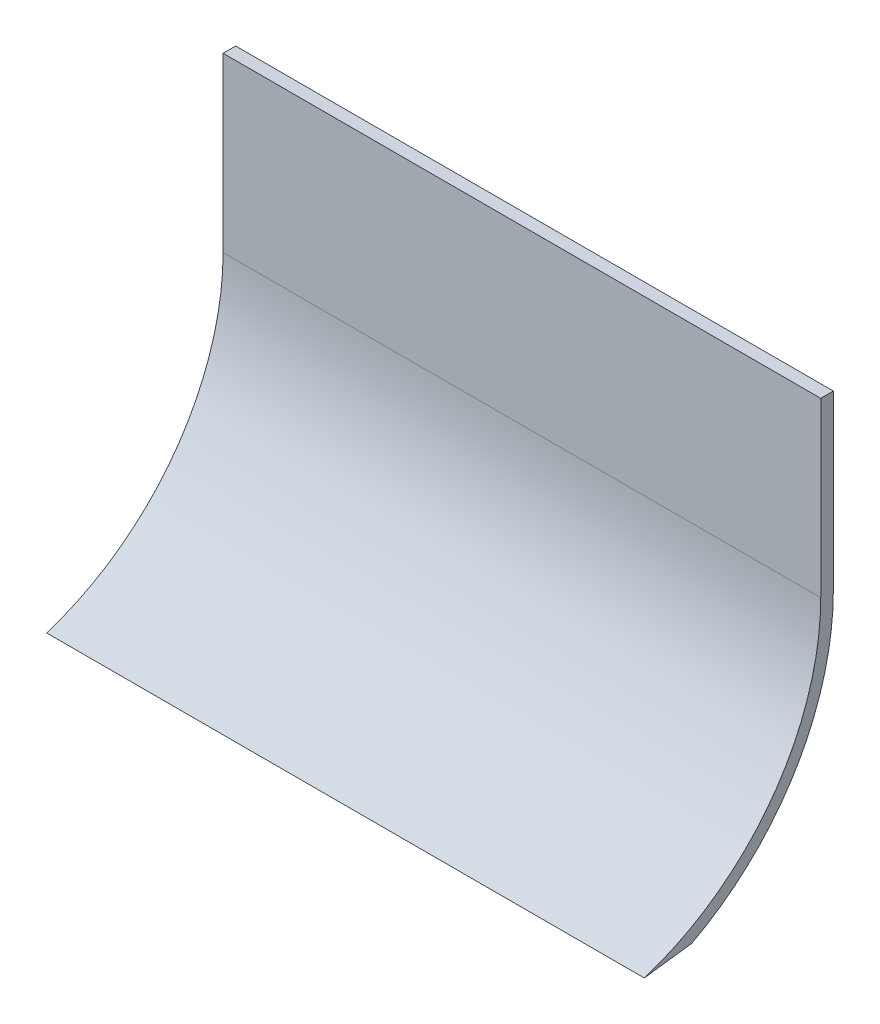
from build123d import *

# Parameters (mm, degrees)
RESSALTO_EXTRUS_O1_DEPTH = 50


with BuildPart() as part:
    # Esboço1 → Ressalto-extrusão1 (new, symmetric)
    with BuildSketch(Plane(origin=(0, 0, 0), x_dir=(0, 0, -1), z_dir=(1, 0, 0))):
        with BuildLine():
            Line((12.814923667, -40.354099314), (20.74666802, -39.311299471))
            ThreePointArc((20.74666802, -39.311299471), (38.065679381, -22.952266843), (44.45, 0))
            Line((44.45, 0), (44.45, 28.878170812))
            Line((44.45, 28.878170812), (42.34, 28.878170812))
            Line((42.34, 28.878170812), (42.34, 0))
            ThreePointArc((42.34, 0), (34.170597508, -25.000917303), (12.814923667, -40.354099314))
        make_face()
    extrude(amount=RESSALTO_EXTRUS_O1_DEPTH, both=True)


solid = part.part
